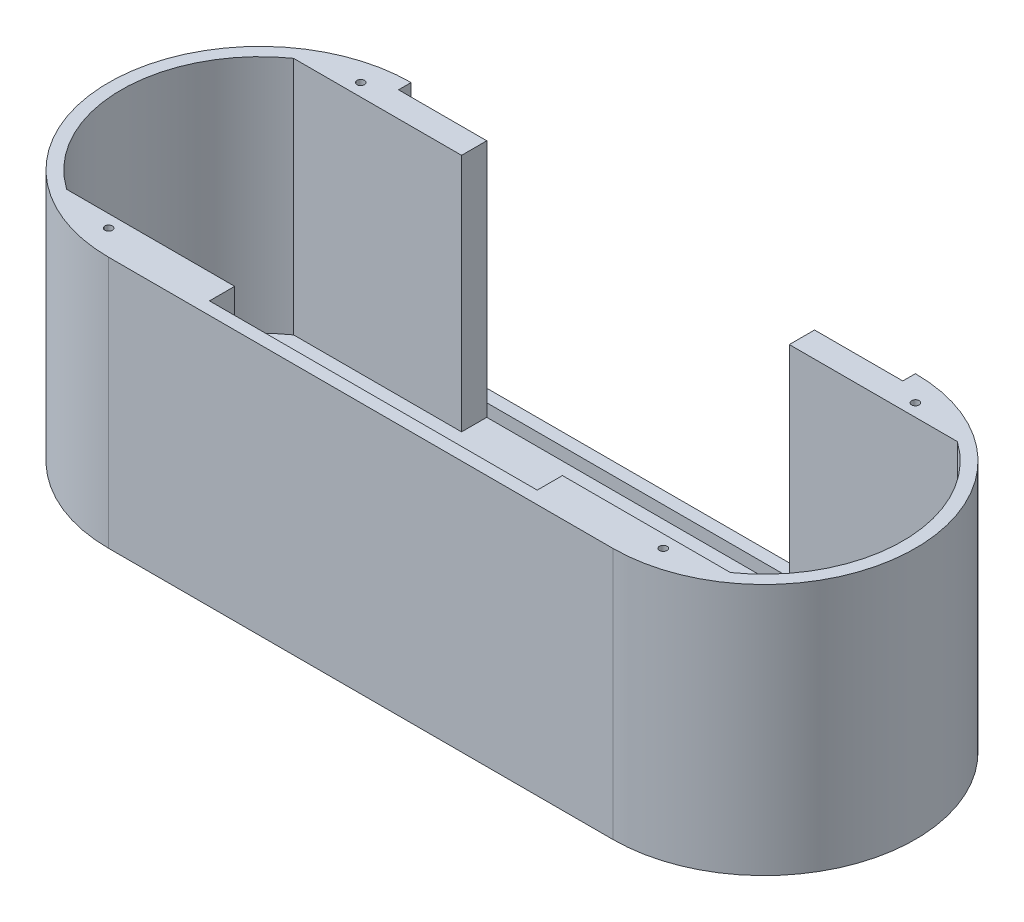
from build123d import *

# Parameters (mm, degrees)
BOSS_EXTRUDE1_DEPTH = 10
CUT_EXTRUDE1_DEPTH  = 9.5
SKETCH3_R           = 0.15
SKETCH3_R_2         = 0.5
CUT_EXTRUDE2_DEPTH  = 20.798989873
SKETCH4_R           = 0.1
SKETCH4_W           = 8.7
SKETCH4_H           = 5.3
CUT_EXTRUDE3_DEPTH  = 20.798989873
CUT_EXTRUDE5_REACH  = 24.361
SKETCH5_W           = 20
SKETCH5_H           = 9
BOSS_EXTRUDE5_START = 9.5
SKETCH6_W           = 3.5
SKETCH6_H           = 1
BOSS_EXTRUDE5_DEPTH = 9.5
SCALE2_SCALE        = 10
SKETCH9_R           = 1.5
CUT_EXTRUDE6_DEPTH  = 10


with BuildPart() as part:
    # Sketch1 → Boss-Extrude1 (new body)
    with BuildSketch(Plane(origin=(0, 0, 0), x_dir=(1, 0, 0), z_dir=(0, 1, 0))):
        with BuildLine():
            Line((-10, 6), (10, 6))
            ThreePointArc((10, 6), (16, 0), (10, -6))
            Line((10, -6), (-10, -6))
            ThreePointArc((-10, -6), (-16, 0), (-10, 6))
        make_face()
    extrude(amount=BOSS_EXTRUDE1_DEPTH)

    # Sketch2 → Cut-Extrude1 (cut)
    with BuildSketch(Plane(origin=(0, 10, 0), x_dir=(1, 0, 0), z_dir=(0, 1, 0))):
        with BuildLine():
            Line((-10, 5.5), (10, 5.5))
            ThreePointArc((10, 5.5), (15.5, 0), (10, -5.5))
            Line((10, -5.5), (-10, -5.5))
            ThreePointArc((-10, -5.5), (-15.5, 0), (-10, 5.5))
        make_face()
    extrude(amount=-CUT_EXTRUDE1_DEPTH, mode=Mode.SUBTRACT)

    # Sketch3 → Cut-Extrude2 (cut, through all)
    with BuildSketch(Plane.XZ):
        with Locations(Location((-13, 3, 0), (0, 0, 270))):
            Circle(SKETCH3_R)
        with Locations(Location((-7, 3, 0), (0, 0, 270))):
            Circle(SKETCH3_R)
        with Locations(Location((-13, -3, 0), (0, 0, 270))):
            Circle(SKETCH3_R)
        with Locations(Location((-7, -3, 0), (0, 0, 270))):
            Circle(SKETCH3_R)
        with Locations(Location((-12.5, 0, 0), (0, 0, 270))):
            Circle(SKETCH3_R_2)
        with Locations(Location((-12.022542486, 1.469463131, 0), (0, 0, 270))):
            Circle(SKETCH3_R_2)
        with Locations(Location((-10.772542486, 2.377641291, 0), (0, 0, 270))):
            Circle(SKETCH3_R_2)
        with Locations(Location((-9.227457514, 2.377641291, 0), (0, 0, 270))):
            Circle(SKETCH3_R_2)
        with Locations(Location((-7.977457514, 1.469463131, 0), (0, 0, 270))):
            Circle(SKETCH3_R_2)
        with Locations(Location((-7.5, 0, 0), (0, 0, 270))):
            Circle(SKETCH3_R_2)
        with Locations(Location((-7.977457514, -1.469463131, 0), (0, 0, 270))):
            Circle(SKETCH3_R_2)
        with Locations(Location((-9.227457514, -2.377641291, 0), (0, 0, 270))):
            Circle(SKETCH3_R_2)
        with Locations(Location((-10.772542486, -2.377641291, 0), (0, 0, 270))):
            Circle(SKETCH3_R_2)
        with Locations(Location((-12.022542486, -1.469463131, 0), (0, 0, 270))):
            Circle(SKETCH3_R_2)
        with Locations(Location((12.022542486, -1.469463131, 0), (0, 0, 90))):
            Circle(SKETCH3_R_2)
        with Locations(Location((10.772542486, -2.377641291, 0), (0, 0, 90))):
            Circle(SKETCH3_R_2)
        with Locations(Location((9.227457514, -2.377641291, 0), (0, 0, 90))):
            Circle(SKETCH3_R_2)
        with Locations(Location((7.977457514, -1.469463131, 0), (0, 0, 90))):
            Circle(SKETCH3_R_2)
        with Locations(Location((7.5, 0, 0), (0, 0, 90))):
            Circle(SKETCH3_R_2)
        with Locations(Location((7.977457514, 1.469463131, 0), (0, 0, 90))):
            Circle(SKETCH3_R_2)
        with Locations(Location((9.227457514, 2.377641291, 0), (0, 0, 90))):
            Circle(SKETCH3_R_2)
        with Locations(Location((10.772542486, 2.377641291, 0), (0, 0, 90))):
            Circle(SKETCH3_R_2)
        with Locations(Location((12.022542486, 1.469463131, 0), (0, 0, 90))):
            Circle(SKETCH3_R_2)
        with Locations(Location((12.5, 0, 0), (0, 0, 90))):
            Circle(SKETCH3_R_2)
        with Locations(Location((7, -3, 0), (0, 0, 90))):
            Circle(SKETCH3_R)
        with Locations(Location((13, -3, 0), (0, 0, 90))):
            Circle(SKETCH3_R)
        with Locations(Location((7, 3, 0), (0, 0, 90))):
            Circle(SKETCH3_R)
        with Locations(Location((13, 3, 0), (0, 0, 90))):
            Circle(SKETCH3_R)
    extrude(amount=-CUT_EXTRUDE2_DEPTH, mode=Mode.SUBTRACT)

    # Sketch4 → Cut-Extrude3 (cut, through all)
    with BuildSketch(Plane.XZ):
        with Locations(Location((-4.572, 2.794, 0), (0, 0, 270))):
            Circle(SKETCH4_R)
        with Locations(Location((4.572, 2.794, 0), (0, 0, 270))):
            Circle(SKETCH4_R)
        with Locations(Location((-4.572, -2.794, 0), (0, 0, 270))):
            Circle(SKETCH4_R)
        with Locations(Location((4.572, -2.794, 0), (0, 0, 270))):
            Circle(SKETCH4_R)
        Rectangle(SKETCH4_W, SKETCH4_H)
    extrude(amount=-CUT_EXTRUDE3_DEPTH, mode=Mode.SUBTRACT)

    # Cut-Extrude5: up to this face of the body (flat: up to its plane)
    cut_extrude5_end = Plane(part.part.faces().sort_by_distance((0, 5.25, -5.5))[0])
    # Sketch5 → Cut-Extrude5 (cut, up to the picked face)
    with BuildSketch(Plane(origin=(0, 0, -6), x_dir=(-1, 0, 0), z_dir=(0, 0, -1)), mode=Mode.PRIVATE) as cut_extrude5_sk1:
        with Locations((0, 5.5)):
            Rectangle(SKETCH5_W, SKETCH5_H)
    cut_extrude5_tool1 = split(extrude(cut_extrude5_sk1.sketch, amount=-CUT_EXTRUDE5_REACH, mode=Mode.PRIVATE), bisect_by=cut_extrude5_end, keep=Keep.BOTH, mode=Mode.PRIVATE)
    add(cut_extrude5_tool1.solids().sort_by(Axis((0, 5.5, -6), (0, 0, 1)))[0], mode=Mode.SUBTRACT)

    # Sketch6 → Boss-Extrude5 (add)
    with BuildSketch(Plane(origin=(0, 0.5, 0), x_dir=(1, 0, 0), z_dir=(0, 1, 0)).offset(BOSS_EXTRUDE5_START)):
        with Locations((8.25, -5)):
            Rectangle(SKETCH6_W, SKETCH6_H)
        with Locations((8.25, 5)):
            Rectangle(SKETCH6_W, SKETCH6_H)
        with BuildLine():
            ThreePointArc((13.16227766, 4.5), (11.658312395, 5.244044241), (10, 5.5))
            Line((10, 5.5), (10, 4.5))
            Line((10, 4.5), (13.16227766, 4.5))
        make_face()
        with BuildLine():
            ThreePointArc((10, -5.5), (11.658312395, -5.244044241), (13.16227766, -4.5))
            Line((13.16227766, -4.5), (10, -4.5))
            Line((10, -4.5), (10, -5.5))
        make_face()
        with Locations((-8.25, -5)):
            Rectangle(SKETCH6_W, SKETCH6_H)
        with Locations((-8.25, 5)):
            Rectangle(SKETCH6_W, SKETCH6_H)
        with BuildLine():
            Line((-10, 4.5), (-10, 5.5))
            ThreePointArc((-10, 5.5), (-11.658312395, 5.244044241), (-13.16227766, 4.5))
            Line((-13.16227766, 4.5), (-10, 4.5))
        make_face()
        with BuildLine():
            Line((-10, -4.5), (-13.16227766, -4.5))
            ThreePointArc((-13.16227766, -4.5), (-11.658312395, -5.244044241), (-10, -5.5))
            Line((-10, -5.5), (-10, -4.5))
        make_face()
    extrude(amount=-BOSS_EXTRUDE5_DEPTH)


with BuildPart() as part_1:
    # Scale2: scaled about (0, 4.064159542, 0.819354557)
    add(part.part.scale(SCALE2_SCALE).moved(Location((0, -36.577435878, -7.374191013))))

    # Sketch9 → Cut-Extrude6 (cut)
    with BuildSketch(Plane(origin=(0, 63.422564119, 0), x_dir=(1, 0, 0), z_dir=(0, 1, 0))):
        with Locations(Location((-110, 57.374191011, 0), (0, 0, 270))):
            Circle(SKETCH9_R)
        with Locations(Location((-110, -42.625808989, 0), (0, 0, 270))):
            Circle(SKETCH9_R)
        with Locations(Location((110, -42.625808989, 0), (0, 0, 270))):
            Circle(SKETCH9_R)
        with Locations(Location((110, 57.374191011, 0), (0, 0, 270))):
            Circle(SKETCH9_R)
    extrude(amount=-CUT_EXTRUDE6_DEPTH, mode=Mode.SUBTRACT)


solid = part_1.part
